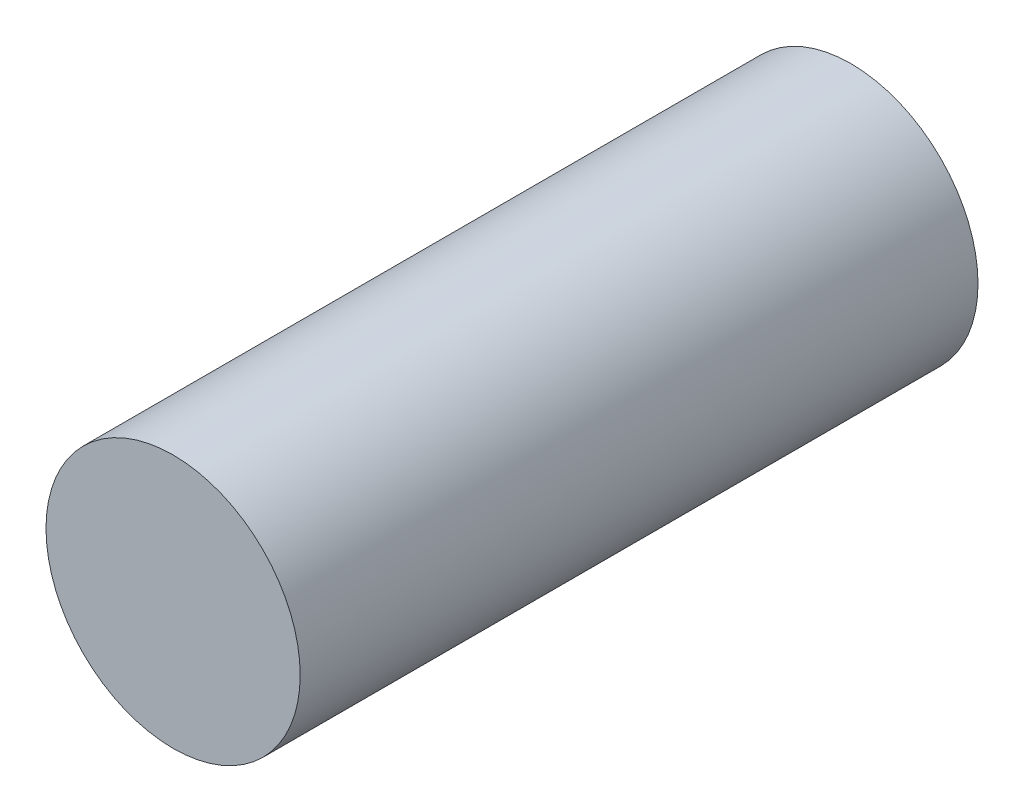
from build123d import *

# Parameters (mm, degrees)
SKETCH2_R           = 4.7625
BOSS_EXTRUDE1_DEPTH = 25.4


with BuildPart() as part:
    # Sketch2 → Boss-Extrude1 (new body)
    with BuildSketch(Plane.XY):
        Circle(SKETCH2_R)
    extrude(amount=BOSS_EXTRUDE1_DEPTH)


solid = part.part
